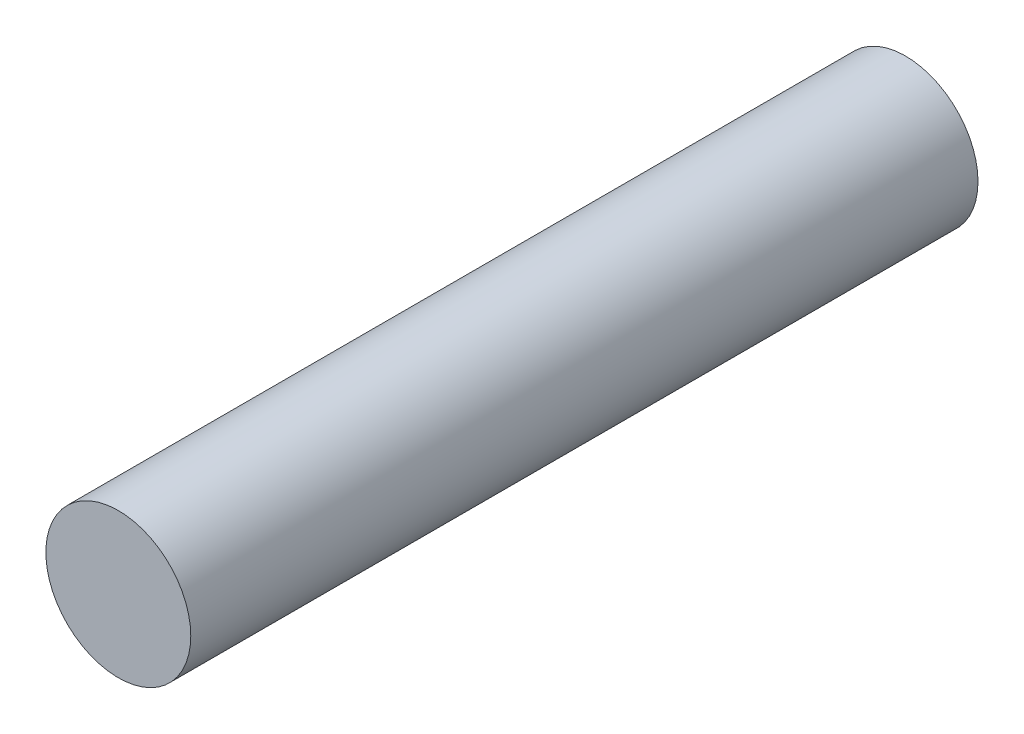
from build123d import *

# Parameters (mm, degrees)
ESQUISSE1_R        = 10.125
BOSS_EXTRU_1_DEPTH = 110


with BuildPart() as part:
    # Esquisse1 → Boss.-Extru.1 (new body)
    with BuildSketch(Plane.XY):
        Circle(ESQUISSE1_R)
    extrude(amount=BOSS_EXTRU_1_DEPTH)


solid = part.part
